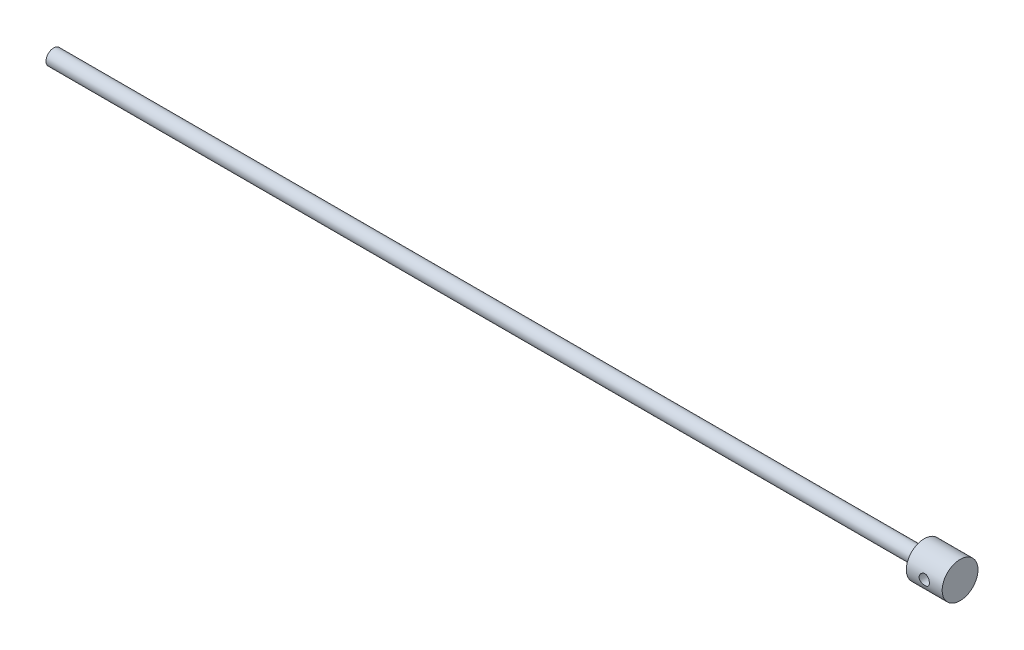
from build123d import *

# Parameters (mm, degrees)
SKETCH1_R               = 7.5
BOSS_EXTRUDE1_DEPTH     = 850
SKETCH2_R               = 17.5
BOSS_EXTRUDE2_DEPTH     = 35
CUT_EXTRUDE2_DEPTH      = 851.36021779
CUT_EXTRUDE2_DEPTH_BACK = 851.36021779
SKETCH3_R               = 5


with BuildPart() as part:
    # Sketch1 → Boss-Extrude1 (new body)
    with BuildSketch(Plane(origin=(0, 0, 0), x_dir=(0, 0, -1), z_dir=(1, 0, 0))):
        Circle(SKETCH1_R)
    extrude(amount=-BOSS_EXTRUDE1_DEPTH)

    # Sketch2 → Boss-Extrude2 (add)
    with BuildSketch(Plane(origin=(0, 0, 0), x_dir=(0, 0, -1), z_dir=(1, 0, 0))):
        Circle(SKETCH2_R)
    extrude(amount=BOSS_EXTRUDE2_DEPTH)

    # Sketch3 → Cut-Extrude2 (cut, two sides: drawn at the far end of the back side and taken through both)
    with BuildSketch(Plane.XY.offset(-CUT_EXTRUDE2_DEPTH_BACK)):
        with Locations((17.5, 0)):
            Circle(SKETCH3_R)
    extrude(amount=CUT_EXTRUDE2_DEPTH + CUT_EXTRUDE2_DEPTH_BACK, mode=Mode.SUBTRACT)


solid = part.part
